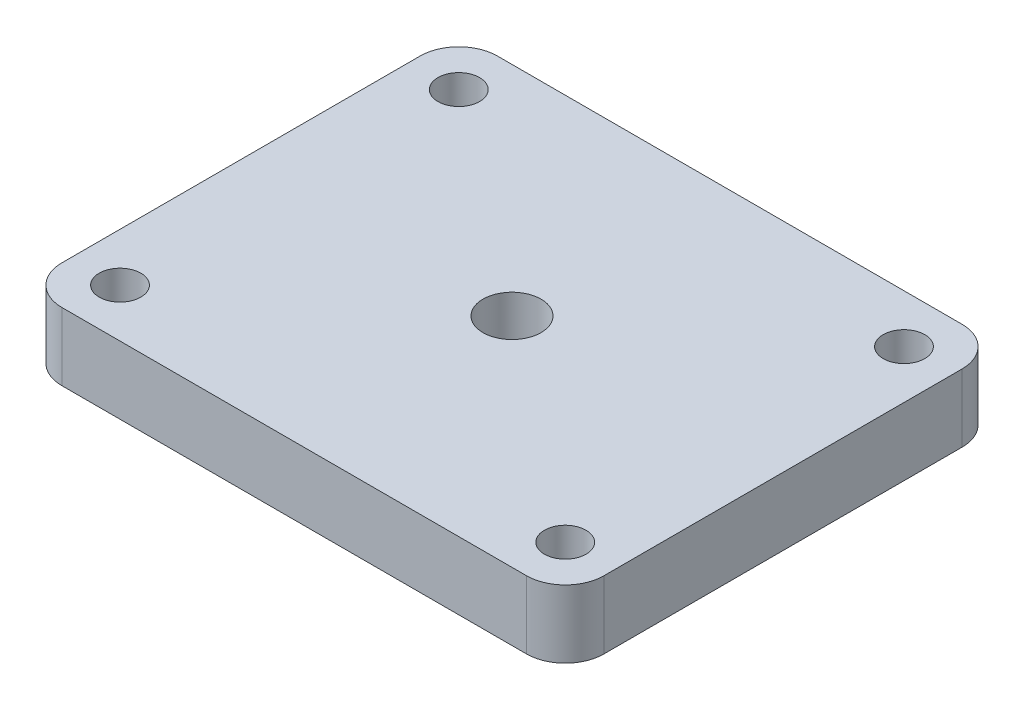
from build123d import *
from build123d.topology import SkipClean

# Parameters (mm, degrees)
SKETCH_1_R      = 2.15
SKETCH_1_R_2    = 3
EXTRUDE_1_DEPTH = 1
EXTRUDE_START   = 6
SKETCH_13_R     = 2.15
SKETCH_13_R_2   = 3
EXTRUDE_5_DEPTH = 6


with BuildPart() as part:
    # 草图1 → 凸台-拉伸1 (new body)
    with BuildSketch(Plane(origin=(0, 0, 0), x_dir=(1, 0, 0), z_dir=(0, 1, 0))):
        with BuildLine():
            Line((-24, -22.5), (24, -22.5))
            ThreePointArc((24, -22.5), (26.828427125, -21.328427125), (28, -18.5))
            Line((28, -18.5), (28, 18.5))
            ThreePointArc((28, 18.5), (26.828427125, 21.328427125), (24, 22.5))
            Line((24, 22.5), (-24, 22.5))
            ThreePointArc((-24, 22.5), (-26.828427125, 21.328427125), (-28, 18.5))
            Line((-28, 18.5), (-28, -18.5))
            ThreePointArc((-28, -18.5), (-26.828427125, -21.328427125), (-24, -22.5))
        make_face()
        with Locations(Location((-23, 17.5, 0), (0, 0, 270))):
            Circle(SKETCH_1_R, mode=Mode.SUBTRACT)
        with Locations(Location((-23, -17.5, 0), (0, 0, 270))):
            Circle(SKETCH_1_R, mode=Mode.SUBTRACT)
        with Locations(Location((23, -17.5, 0), (0, 0, 270))):
            Circle(SKETCH_1_R, mode=Mode.SUBTRACT)
        with Locations(Location((23, 17.5, 0), (0, 0, 270))):
            Circle(SKETCH_1_R, mode=Mode.SUBTRACT)
        with Locations(Location((0, 0, 0), (0, 0, 270))):
            Circle(SKETCH_1_R_2, mode=Mode.SUBTRACT)
    extrude(amount=EXTRUDE_1_DEPTH)

    # 草图13 → 凸台-拉伸5 (add)
    with SkipClean():  # the faces are left unmerged after this step: merging them gives an invalid solid
        with BuildSketch(Plane.XZ.offset(EXTRUDE_START)):
            with BuildLine():
                Line((-24, -22.5), (24, -22.5))
                ThreePointArc((24, -22.5), (26.828427125, -21.328427125), (28, -18.5))
                Line((28, -18.5), (28, 18.5))
                ThreePointArc((28, 18.5), (26.828427125, 21.328427125), (24, 22.5))
                Line((24, 22.5), (-24, 22.5))
                ThreePointArc((-24, 22.5), (-26.828427125, 21.328427125), (-28, 18.5))
                Line((-28, 18.5), (-28, -18.5))
                ThreePointArc((-28, -18.5), (-26.828427125, -21.328427125), (-24, -22.5))
            make_face()
            with Locations(Location((-23, 17.5, 0), (0, 0, 270))):
                Circle(SKETCH_13_R, mode=Mode.SUBTRACT)
            with Locations(Location((-23, -17.5, 0), (0, 0, 270))):
                Circle(SKETCH_13_R, mode=Mode.SUBTRACT)
            with Locations(Location((23, -17.5, 0), (0, 0, 270))):
                Circle(SKETCH_13_R, mode=Mode.SUBTRACT)
            with Locations(Location((23, 17.5, 0), (0, 0, 270))):
                Circle(SKETCH_13_R, mode=Mode.SUBTRACT)
            with Locations(Location((0, 0, 0), (0, 0, 270))):
                Circle(SKETCH_13_R_2, mode=Mode.SUBTRACT)
        extrude(amount=-EXTRUDE_5_DEPTH)


solid = part.part
